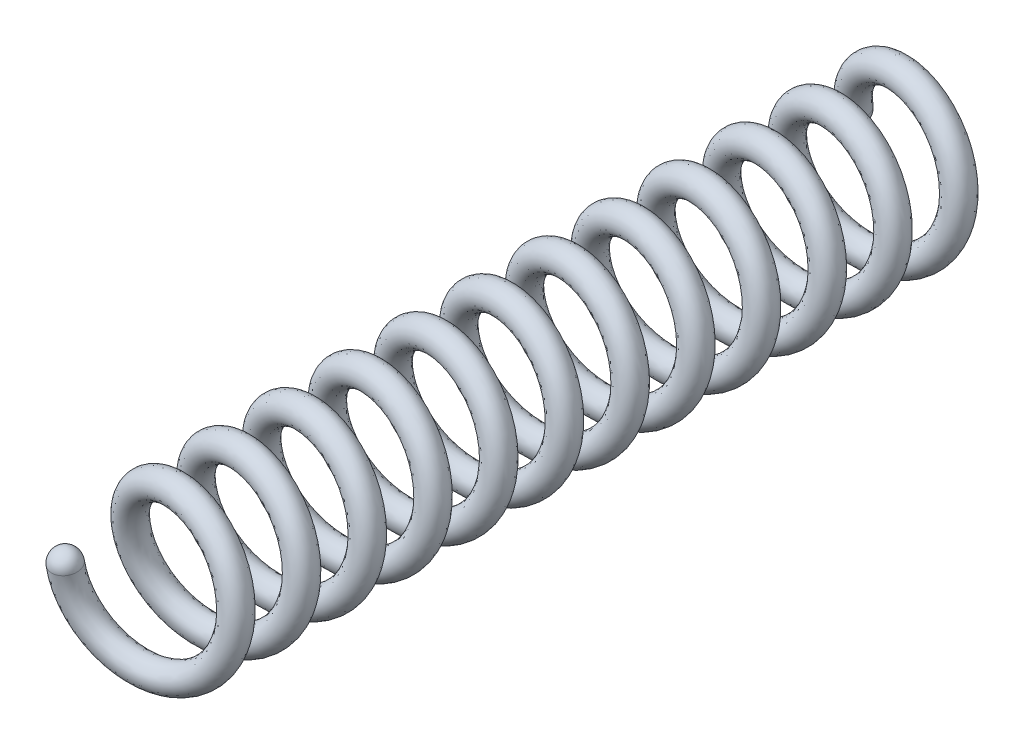
from build123d import *

# Parameters (mm, degrees)
SWEEP1_PITCH       = 24
SWEEP1_HEIGHT      = 288
SWEEP1_RADIUS      = 25
SWEEP1_START_ANGLE = -180
SWEEP1_PROFILE_R   = 5
REVOLVE4_ANGLE     = 180
REVOLVE5_ANGLE     = 180


with BuildPart() as part:
    # Sweep1: sweep along a helix
    with BuildLine() as sweep1_path:
        add(Helix(SWEEP1_PITCH, SWEEP1_HEIGHT, SWEEP1_RADIUS, center=(0, 0, 0), direction=(0, 0, 1), lefthand=True, mode=Mode.PRIVATE).rotate(Axis((0, 0, 0), (0, 0, 1)), SWEEP1_START_ANGLE))
    # Sweep1 profile (on start of the path) → Sweep1 (sweep)
    with BuildSketch(Plane(origin=(-25, 0, 0), x_dir=(0, -0.1510359932195364, 0.9885282640128142), z_dir=(-1.6366602690024321e-13, 0.9885282640128142, 0.1510359932195364))):
        Circle(SWEEP1_PROFILE_R)
    sweep(path=sweep1_path.line, is_frenet=True)

    # Sketch45 → Revolve4 (revolve)
    with BuildSketch(Plane(origin=(0, 0, 0), x_dir=(1, 0, 0), z_dir=(-7.31359417471822e-15, 0.9885282640128136, 0.15103599321954156))):
        with BuildLine():
            Line((-21.891475893, -3.916258147), (-28.108524107, 3.916258147))
            ThreePointArc((-28.108524107, 3.916258147), (-21.083741853, 3.108524107), (-21.891475893, -3.916258147))
        make_face()
    revolve(axis=Axis((-21.891475893, -0.591495939, 3.871331868), (-0.6217048214552674, 0.11829918778932358, -0.7742663735095697)), revolution_arc=REVOLVE4_ANGLE)

    # Sketch47 → Revolve5 (revolve)
    with BuildSketch(Plane(origin=(0, 42.999364276, 6.569818919), x_dir=(-1, 0, 0), z_dir=(7.119305145408816e-15, -0.9885282640128135, -0.15103599321954186))):
        with BuildLine():
            Line((29.996586816, -284.511423512), (20.003413184, -284.88085656))
            ThreePointArc((20.003413184, -284.88085656), (25.184716524, -289.692726851), (29.996586816, -284.511423512))
        make_face()
    revolve(axis=Axis((-29.996586816, 0.027898844, 287.817402495), (-0.9993173631175231, 0.005579768737964258, -0.03651950099154422)), revolution_arc=REVOLVE5_ANGLE)


solid = part.part
